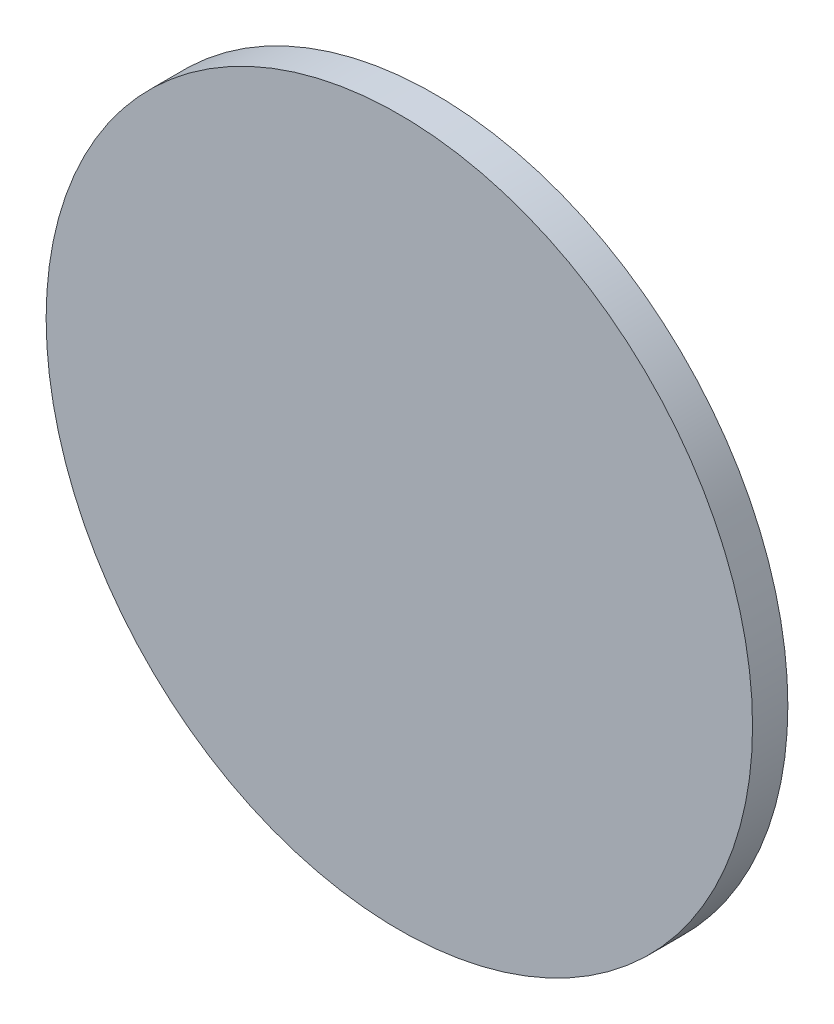
from build123d import *

# Parameters (mm, degrees)
SKETCH_1_R      = 100
EXTRUDE_1_DEPTH = 10


with BuildPart() as part:
    # ｽｹｯﾁ1 → ﾎﾞｽ - 押し出し1 (new body)
    with BuildSketch(Plane.XY):
        Circle(SKETCH_1_R)
    extrude(amount=EXTRUDE_1_DEPTH)


solid = part.part
